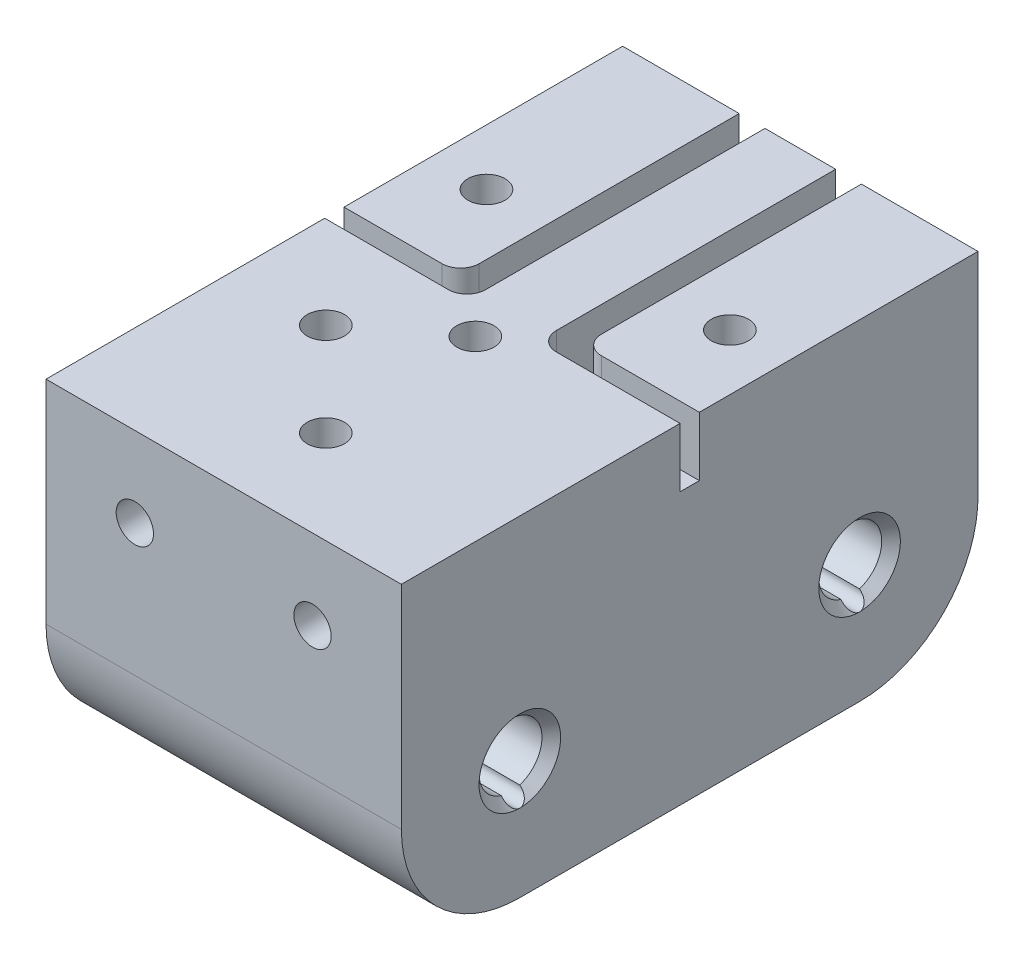
from build123d import *

# Parameters (mm, degrees)
SKETCH1_R           = 3.375
BOSS_EXTRUDE2_DEPTH = 38.1
BOSS_EXTRUDE3_REACH = 82.814
SKETCH6_W           = 38.1
SKETCH6_H           = 36.425
SKETCH10_R          = 2
CUT_EXTRUDE6_DEPTH  = 8
CHAMFER1_SIZE       = 1
CUT_EXTRUDE11_DEPTH = 6.35
SKETCH16_R          = 2
CUT_EXTRUDE10_DEPTH = 5
SKETCH17_R          = 1
CUT_EXTRUDE12_DEPTH = 77.103956903
FILLET1_R           = 2


with BuildPart() as part:
    # Sketch1 → Boss-Extrude2 (new body)
    with BuildSketch(Plane(origin=(0, 0, 0), x_dir=(0, 0, -1), z_dir=(1, 0, 0))):
        with BuildLine():
            Line((61.825, 22.75), (0, 22.75))
            Line((0, 22.75), (0, 0))
            Line((0, 0), (0.0025, 0))
            ThreePointArc((0.0025, 0), (12.7025, -12.7), (25.4025, 0))
            Line((25.4025, 0), (36.4275, 0))
            ThreePointArc((36.4275, 0), (49.253496032, -12.699374985), (61.825, 0.251979662))
            Line((61.825, 0.251979662), (61.825, 22.75))
        make_face()
        with Locations(Location((49.1275, 0, 0), (0, 0, 180))):
            Circle(SKETCH1_R, mode=Mode.SUBTRACT)
        with Locations(Location((12.7025, 0, 0), (0, 0, 180))):
            Circle(SKETCH1_R, mode=Mode.SUBTRACT)
    extrude(amount=BOSS_EXTRUDE2_DEPTH)

    # Sketch6 → Boss-Extrude3 (add, up to next)
    with BuildSketch(Plane(origin=(0, -12.7, 0), x_dir=(-1, 0, 0), z_dir=(0, -1, 0)), mode=Mode.PRIVATE) as boss_extrude3_sk1:
        with Locations((-19.05, 30.915)):
            Rectangle(SKETCH6_W, SKETCH6_H)
    boss_extrude3_tool1 = extrude(boss_extrude3_sk1.sketch, amount=-BOSS_EXTRUDE3_REACH, mode=Mode.PRIVATE) - part.part
    add(boss_extrude3_tool1.solids().sort_by_distance((19.05, -12.7, -30.915))[0])

    # Sketch10 → Cut-Extrude6 (cut)
    with BuildSketch(Plane.XY):
        with Locations((9.525, 14.153125)):
            Circle(SKETCH10_R)
        with Locations((28.575, 14.153125)):
            Circle(SKETCH10_R)
    extrude(amount=-CUT_EXTRUDE6_DEPTH, mode=Mode.SUBTRACT)

    # Chamfer1
    chamfer1_edges = [part.edges().sort_by_distance(p)[0] for p in [
        (0, 0, -16.0775),
        (0, 0, -52.5025),
        (38.1, 0, -16.0775),
        (38.1, 0, -52.5025),
    ]]
    chamfer(chamfer1_edges, length=CHAMFER1_SIZE)

    # Sketch15 → Cut-Extrude11 (cut)
    with BuildSketch(Plane(origin=(0, 22.75, 0), x_dir=(1, 0, 0), z_dir=(0, 1, 0))):
        Polygon((12.5, 31.95), (0, 31.95), (0, 29.88), (15.26, 29.88), (15.26, 61.825), (12.5, 61.825), align=None)
        Polygon((25.6, 61.825), (22.84, 61.825), (22.84, 29.88), (38.1, 29.88), (38.1, 31.95), (25.6, 31.95), align=None)
    extrude(amount=-CUT_EXTRUDE11_DEPTH, mode=Mode.SUBTRACT)

    # Sketch16 → Cut-Extrude10 (cut)
    with BuildSketch(Plane(origin=(0, 22.75, 0), x_dir=(1, 0, 0), z_dir=(0, 1, 0))):
        with Locations(Location((32.1, 41.225, 0), (0, 0, 270))):
            Circle(SKETCH16_R)
        with BuildLine():
            ThreePointArc((21.05, 26.985), (20.464213562, 28.399213562), (19.05, 28.985))
            Line((19.05, 28.985), (19.05, 24.985))
            ThreePointArc((19.05, 24.985), (20.464213562, 25.570786438), (21.05, 26.985))
        make_face()
        with BuildLine():
            Line((19.05, 24.985), (19.05, 28.985))
            ThreePointArc((19.05, 28.985), (17.05, 26.985), (19.05, 24.985))
        make_face()
        with Locations(Location((6, 41.225, 0), (0, 0, 270))):
            Circle(SKETCH16_R)
        with Locations(Location((10, 20, 0), (0, 0, 270))):
            Circle(SKETCH16_R)
        with Locations(Location((20, 10, 0), (0, 0, 270))):
            Circle(SKETCH16_R)
    extrude(amount=-CUT_EXTRUDE10_DEPTH, mode=Mode.SUBTRACT)

    # Sketch17 → Cut-Extrude12 (cut, through all)
    with BuildSketch(Plane(origin=(38.1, 0, 0), x_dir=(0, 0, -1), z_dir=(1, 0, 0))):
        with Locations((12.7025, -3.375)):
            Circle(SKETCH17_R)
        with Locations((49.1275, -3.375)):
            Circle(SKETCH17_R)
    extrude(amount=-CUT_EXTRUDE12_DEPTH, mode=Mode.SUBTRACT)

    # Fillet1
    fillet1_edges = [part.edges().sort_by_distance(p)[0] for p in [
        (15.26, 19.575, -29.88),
        (12.5, 19.575, -31.95),
        (22.84, 19.575, -29.88),
        (25.6, 19.575, -31.95),
    ]]
    fillet(fillet1_edges, radius=FILLET1_R)


solid = part.part
